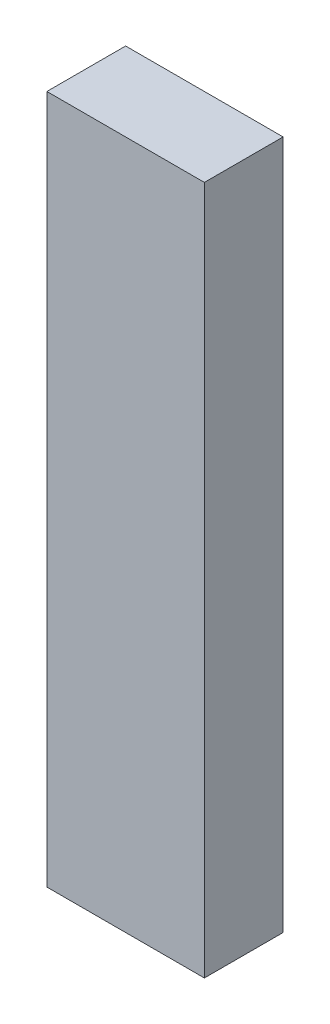
from build123d import *

# Parameters (mm, degrees)
SKETCH1_W           = 10.16
SKETCH1_H           = 44.45
BOSS_EXTRUDE1_DEPTH = 5.08


with BuildPart() as part:
    # Sketch1 → Boss-Extrude1 (new body)
    with BuildSketch(Plane.XY):
        Rectangle(SKETCH1_W, SKETCH1_H)
    extrude(amount=BOSS_EXTRUDE1_DEPTH)


solid = part.part
